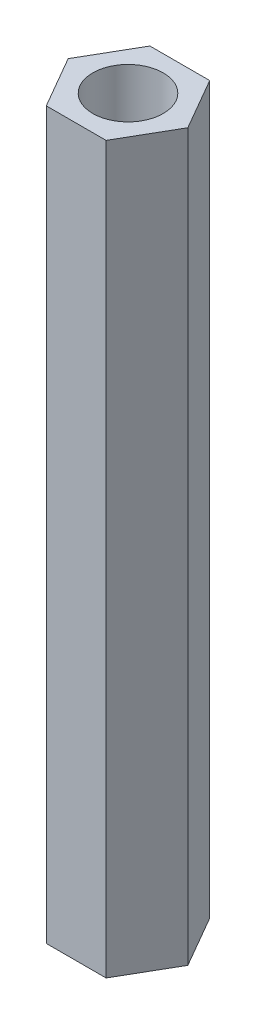
from build123d import *

# Parameters (mm, degrees)
HEX_STANDOFF_DEPTH       = 35
M3_CLEARANCE_HOLE1_D     = 3.4
M3_CLEARANCE_HOLE1_DEPTH = 5
M3_CLEARANCE_HOLE1_TIP   = 1.021463052
M3_CLEARANCE_HOLE5_D     = 3.4
M3_CLEARANCE_HOLE5_DEPTH = 5
M3_CLEARANCE_HOLE5_TIP   = 1.021463052


with BuildPart() as part:
    # Sketch1 → Hex Standoff (new body)
    with BuildSketch(Plane(origin=(0, 0, 0), x_dir=(1, 0, 0), z_dir=(0, 1, 0))):
        Polygon((-1.443375673, 2.5), (1.443375673, 2.5), (2.886751346, 0), (1.443375673, -2.5), (-1.443375673, -2.5), (-2.886751346, 0), align=None)
    extrude(amount=HEX_STANDOFF_DEPTH)

    # M3 Clearance Hole1
    with Locations(Plane(origin=(0, 35, 0), x_dir=(1, 0, 0), z_dir=(0, 1, 0))):
        with Locations((0, 0)):
            Hole(M3_CLEARANCE_HOLE1_D / 2, depth=M3_CLEARANCE_HOLE1_DEPTH)
            with Locations((0, 0, -(M3_CLEARANCE_HOLE1_DEPTH + M3_CLEARANCE_HOLE1_TIP / 2))):  # 118° drill point
                Cone(0, M3_CLEARANCE_HOLE1_D / 2, M3_CLEARANCE_HOLE1_TIP, mode=Mode.SUBTRACT)

    # M3 Clearance Hole5
    with Locations(Plane.XZ):
        with Locations((0, 0)):
            Hole(M3_CLEARANCE_HOLE5_D / 2, depth=M3_CLEARANCE_HOLE5_DEPTH)
            with Locations((0, 0, -(M3_CLEARANCE_HOLE5_DEPTH + M3_CLEARANCE_HOLE5_TIP / 2))):  # 118° drill point
                Cone(0, M3_CLEARANCE_HOLE5_D / 2, M3_CLEARANCE_HOLE5_TIP, mode=Mode.SUBTRACT)


solid = part.part
